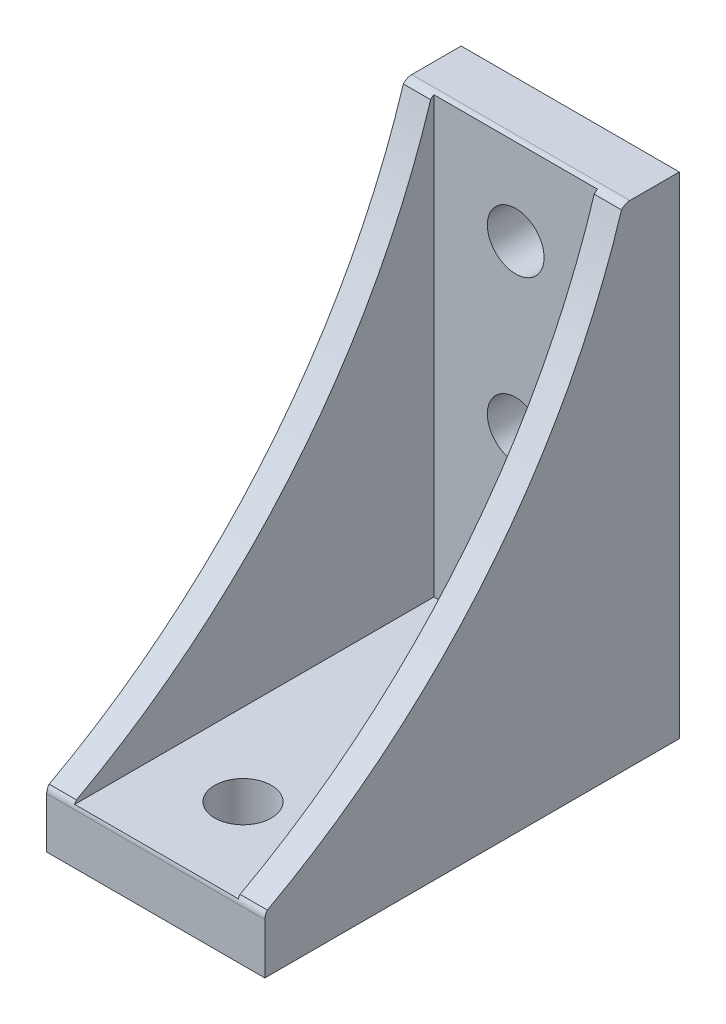
from build123d import *
from build123d.topology import SkipClean

# Parameters (mm, degrees)
EXTRUDE_1_DEPTH          = 10
EXTRUDE_1_DEPTH_BACK     = 10
CUT_EXTRUDE_1_DEPTH      = 7.5
CUT_EXTRUDE_1_DEPTH_BACK = 7.5
SKETCH_2_W               = 38
SKETCH_2_H               = 45
CUT_EXTRUDE_2_DEPTH      = 10
CUT_EXTRUDE_2_DEPTH_BACK = 10
SKETCH_4_R               = 2.6
CUT_EXTRUDE_3_DEPTH      = 5
SKETCH_5_R               = 2.6
CUT_EXTRUDE_4_DEPTH      = 5
SKETCH_6_R               = 2.6
CUT_EXTRUDE_5_DEPTH      = 5
SKETCH_7_R               = 2.6
CUT_EXTRUDE_6_DEPTH      = 5
SKETCH_8_W               = 20
SKETCH_8_H               = 38
EXTRUDE_2_DEPTH          = 0.8
SKETCH_9_W               = 20
SKETCH_9_H               = 45
EXTRUDE_3_DEPTH          = 0.8
CUT_EXTRUDE_START        = -0.8
SKETCH_10_W              = 20
SKETCH_10_H              = 38
CUT_EXTRUDE_7_DEPTH      = 0.8
SKETCH_11_W              = 20
SKETCH_11_H              = 45
CUT_EXTRUDE_8_DEPTH      = 1.25


with BuildPart() as part:
    # 草圖1 → 填料-伸長1 (new, two sides: drawn at the far end of the back side and taken through both)
    with BuildSketch(Plane(origin=(0, 0, 0), x_dir=(0, 0, -1), z_dir=(1, 0, 0)).offset(-EXTRUDE_1_DEPTH_BACK)):
        with BuildLine():
            Line((-38, 0), (0, 0))
            Line((0, 0), (0, 45))
            Line((0, 45), (-4.528610784, 45))
            ThreePointArc((-4.528610784, 45), (-4.95500089, 44.904539373), (-5.299984062, 44.636382955))
            Line((-5.299984062, 44.636382955), (-37.771373279, 5.277123299))
            ThreePointArc((-37.771373279, 5.277123299), (-37.94110926, 4.978842933), (-38, 4.640740344))
            Line((-38, 4.640740344), (-38, 0))
        make_face()
    extrude(amount=EXTRUDE_1_DEPTH + EXTRUDE_1_DEPTH_BACK)

    # 草圖2 → 除料-伸長1 (cut, two sides: drawn at the far end of the back side and taken through both)
    with BuildSketch(Plane(origin=(0, 0, 0), x_dir=(0, 0, -1), z_dir=(1, 0, 0)).offset(-CUT_EXTRUDE_1_DEPTH_BACK)):
        with Locations((-24, 27.5)):
            Rectangle(SKETCH_2_W, SKETCH_2_H)
    extrude(amount=CUT_EXTRUDE_1_DEPTH + CUT_EXTRUDE_1_DEPTH_BACK, mode=Mode.SUBTRACT)

    # 草圖3 → 除料-伸長2 (cut, two sides: drawn at the far end of the back side and taken through both)
    with BuildSketch(Plane(origin=(0, 0, 0), x_dir=(0, 0, -1), z_dir=(1, 0, 0)).offset(-CUT_EXTRUDE_2_DEPTH_BACK)):
        with BuildLine():
            Line((-5.299984062, 44.636382955), (-37.771373279, 5.277123299))
            ThreePointArc((-37.771373279, 5.277123299), (-17.678812278, 21.774838353), (-5.299984062, 44.636382955))
        make_face()
    extrude(amount=CUT_EXTRUDE_2_DEPTH + CUT_EXTRUDE_2_DEPTH_BACK, mode=Mode.SUBTRACT)

    # 草圖4 → 除料-伸長3 (cut)
    with BuildSketch(Plane(origin=(0, 0, 0), x_dir=(1, 0, 0), z_dir=(0, 1, 0))):
        with Locations((0, -10)):
            Circle(SKETCH_4_R)
    extrude(amount=CUT_EXTRUDE_3_DEPTH, mode=Mode.SUBTRACT)

    # 草圖5 → 除料-伸長4 (cut)
    with BuildSketch(Plane(origin=(0, 0, 0), x_dir=(1, 0, 0), z_dir=(0, 1, 0))):
        with Locations((0, -30)):
            Circle(SKETCH_5_R)
    extrude(amount=CUT_EXTRUDE_4_DEPTH, mode=Mode.SUBTRACT)

    # 草圖6 → 除料-伸長5 (cut)
    with BuildSketch(Plane.XY):
        with Locations((0, 22)):
            Circle(SKETCH_6_R)
    extrude(amount=CUT_EXTRUDE_5_DEPTH, mode=Mode.SUBTRACT)

    # 草圖7 → 除料-伸長6 (cut)
    with BuildSketch(Plane.XY):
        with Locations((0, 37)):
            Circle(SKETCH_7_R)
    extrude(amount=CUT_EXTRUDE_6_DEPTH, mode=Mode.SUBTRACT)

    # 草圖8 → 填料-伸長2 (add)
    with BuildSketch(Plane(origin=(0, 0, 0), x_dir=(1, 0, 0), z_dir=(0, 1, 0))):
        with Locations((0, -19)):
            Rectangle(SKETCH_8_W, SKETCH_8_H)
    extrude(amount=-EXTRUDE_2_DEPTH)

    # 草圖9 → 填料-伸長3 (add)
    with BuildSketch(Plane.XY):
        with Locations((0, 22.5)):
            Rectangle(SKETCH_9_W, SKETCH_9_H)
    extrude(amount=-EXTRUDE_3_DEPTH)

    # 草圖10 → 除料-伸長7 (cut)
    with SkipClean():  # the faces are left unmerged after this step: merging them gives an invalid solid
        with BuildSketch(Plane(origin=(0, 0, 0), x_dir=(1, 0, 0), z_dir=(0, 1, 0)).offset(CUT_EXTRUDE_START)):
            with Locations((0, -19)):
                Rectangle(SKETCH_10_W, SKETCH_10_H)
            with BuildLine():
                Line((0.5, -33), (2, -33))
                ThreePointArc((2, -33), (2.707106781, -32.707106781), (3, -32))
                Line((3, -32), (3, -30.5))
                Line((3, -30.5), (2.551470164, -30.5))
                ThreePointArc((2.551470164, -30.5), (1.838477631, -31.838477631), (0.5, -32.551470164))
                Line((0.5, -32.551470164), (0.5, -33))
            make_face(mode=Mode.SUBTRACT)
            with BuildLine():
                Line((0.5, -27), (0.5, -27.448529836))
                ThreePointArc((0.5, -27.448529836), (1.838477631, -28.161522369), (2.551470164, -29.5))
                Line((2.551470164, -29.5), (3, -29.5))
                Line((3, -29.5), (3, -28))
                ThreePointArc((3, -28), (2.707106781, -27.292893219), (2, -27))
                Line((2, -27), (0.5, -27))
            make_face(mode=Mode.SUBTRACT)
            with BuildLine():
                Line((0.5, -13), (2, -13))
                ThreePointArc((2, -13), (2.707106781, -12.707106781), (3, -12))
                Line((3, -12), (3, -10.5))
                Line((3, -10.5), (2.551470164, -10.5))
                ThreePointArc((2.551470164, -10.5), (1.838477631, -11.838477631), (0.5, -12.551470164))
                Line((0.5, -12.551470164), (0.5, -13))
            make_face(mode=Mode.SUBTRACT)
            with BuildLine():
                Line((0.5, -7), (0.5, -7.448529836))
                ThreePointArc((0.5, -7.448529836), (1.838477631, -8.161522369), (2.551470164, -9.5))
                Line((2.551470164, -9.5), (3, -9.5))
                Line((3, -9.5), (3, -8))
                ThreePointArc((3, -8), (2.707106781, -7.292893219), (2, -7))
                Line((2, -7), (0.5, -7))
            make_face(mode=Mode.SUBTRACT)
            with BuildLine():
                Line((-2, -33), (-0.5, -33))
                Line((-0.5, -33), (-0.5, -32.551470164))
                ThreePointArc((-0.5, -32.551470164), (-1.838477631, -31.838477631), (-2.551470164, -30.5))
                Line((-2.551470164, -30.5), (-3, -30.5))
                Line((-3, -30.5), (-3, -32))
                ThreePointArc((-3, -32), (-2.707106781, -32.707106781), (-2, -33))
            make_face(mode=Mode.SUBTRACT)
            with BuildLine():
                Line((-3, -29.5), (-2.551470164, -29.5))
                ThreePointArc((-2.551470164, -29.5), (-1.838477631, -28.161522369), (-0.5, -27.448529836))
                Line((-0.5, -27.448529836), (-0.5, -27))
                Line((-0.5, -27), (-2, -27))
                ThreePointArc((-2, -27), (-2.707106781, -27.292893219), (-3, -28))
                Line((-3, -28), (-3, -29.5))
            make_face(mode=Mode.SUBTRACT)
            with BuildLine():
                Line((-2, -13), (-0.5, -13))
                Line((-0.5, -13), (-0.5, -12.551470164))
                ThreePointArc((-0.5, -12.551470164), (-1.838477631, -11.838477631), (-2.551470164, -10.5))
                Line((-2.551470164, -10.5), (-3, -10.5))
                Line((-3, -10.5), (-3, -12))
                ThreePointArc((-3, -12), (-2.707106781, -12.707106781), (-2, -13))
            make_face(mode=Mode.SUBTRACT)
            with BuildLine():
                Line((-3, -9.5), (-2.551470164, -9.5))
                ThreePointArc((-2.551470164, -9.5), (-1.838477631, -8.161522369), (-0.5, -7.448529836))
                Line((-0.5, -7.448529836), (-0.5, -7))
                Line((-0.5, -7), (-2, -7))
                ThreePointArc((-2, -7), (-2.707106781, -7.292893219), (-3, -8))
                Line((-3, -8), (-3, -9.5))
            make_face(mode=Mode.SUBTRACT)
        extrude(amount=CUT_EXTRUDE_7_DEPTH, mode=Mode.SUBTRACT)

    # 草圖11 → 除料-伸長8 (cut)
    with SkipClean():  # the faces are left unmerged after this step: merging them gives an invalid solid
        with BuildSketch(Plane.XY):
            with Locations((0, 22.5)):
                Rectangle(SKETCH_11_W, SKETCH_11_H)
            with BuildLine():
                Line((-2.7, 27), (2.7, 27))
                ThreePointArc((2.7, 27), (2.912132034, 27.087867966), (3, 27.3))
                Line((3, 27.3), (3, 32.7))
                ThreePointArc((3, 32.7), (2.912132034, 32.912132034), (2.7, 33))
                Line((2.7, 33), (-2.7, 33))
                ThreePointArc((-2.7, 33), (-2.912132034, 32.912132034), (-3, 32.7))
                Line((-3, 32.7), (-3, 27.3))
                ThreePointArc((-3, 27.3), (-2.912132034, 27.087867966), (-2.7, 27))
            make_face(mode=Mode.SUBTRACT)
            with BuildLine():
                Line((-2.7, 3), (2.7, 3))
                ThreePointArc((2.7, 3), (2.912132034, 3.087867966), (3, 3.3))
                Line((3, 3.3), (3, 7.7))
                ThreePointArc((3, 7.7), (2.912132034, 7.912132034), (2.7, 8))
                Line((2.7, 8), (-2.7, 8))
                ThreePointArc((-2.7, 8), (-2.912132034, 7.912132034), (-3, 7.7))
                Line((-3, 7.7), (-3, 3.3))
                ThreePointArc((-3, 3.3), (-2.912132034, 3.087867966), (-2.7, 3))
            make_face(mode=Mode.SUBTRACT)
        extrude(amount=-CUT_EXTRUDE_8_DEPTH, mode=Mode.SUBTRACT)


solid = part.part
